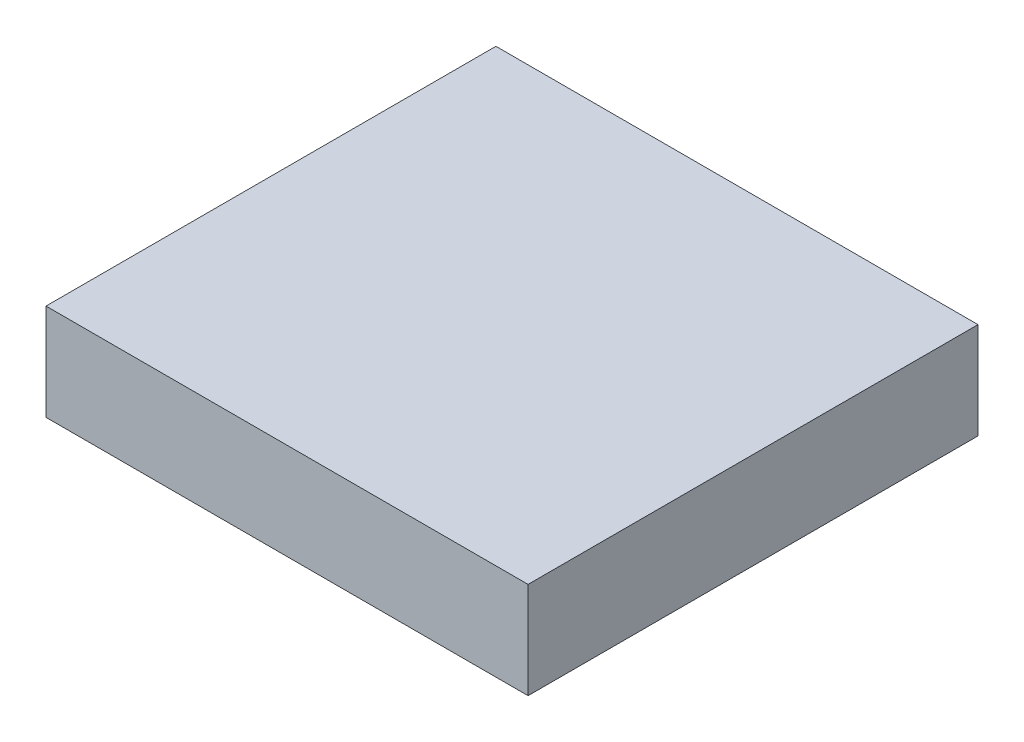
from build123d import *

# Parameters (mm, degrees)
ESBO_O1_W                = 150
ESBO_O1_H                = 140
RESSALTO_EXTRUS_O1_DEPTH = 15


with BuildPart() as part:
    # Esboço1 → Ressalto-extrusão1 (new, symmetric)
    with BuildSketch(Plane(origin=(0, 0, 0), x_dir=(1, 0, 0), z_dir=(0, 1, 0))):
        Rectangle(ESBO_O1_W, ESBO_O1_H)
    extrude(amount=RESSALTO_EXTRUS_O1_DEPTH, both=True)


solid = part.part
